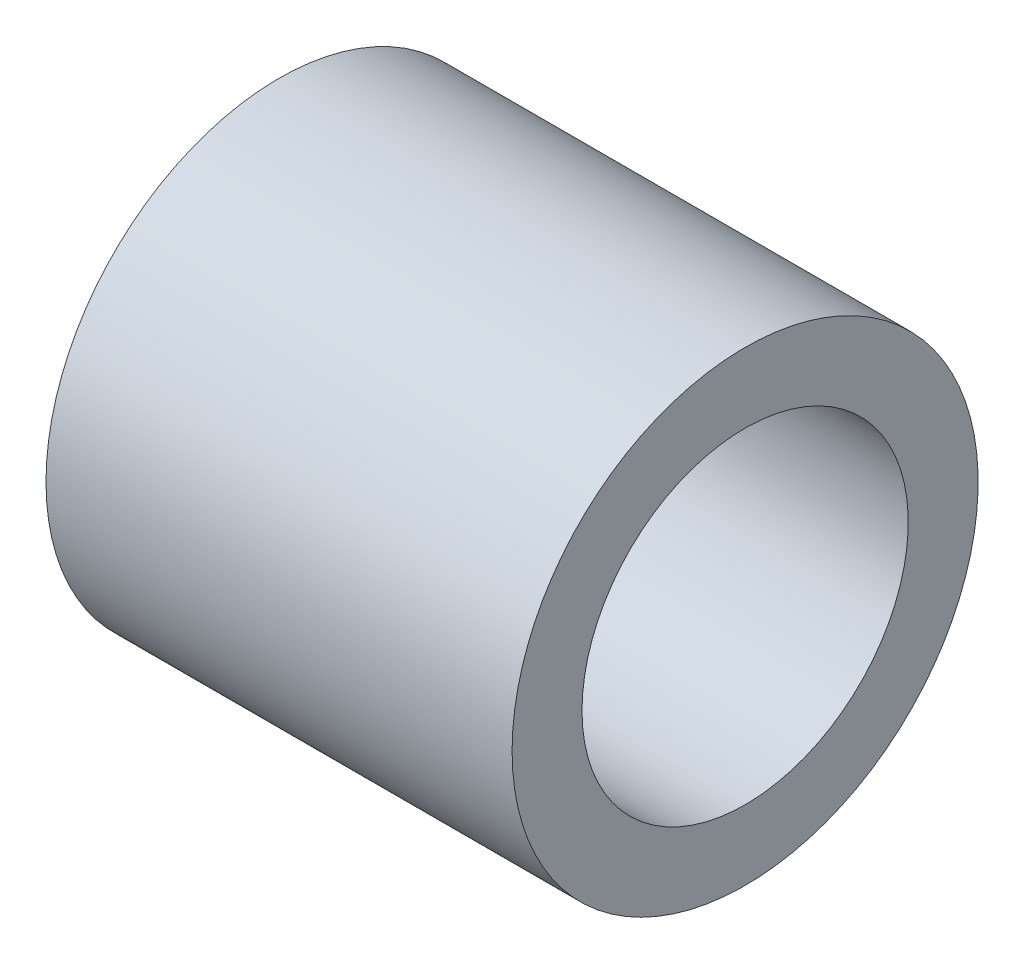
from build123d import *

# Parameters (mm, degrees)
ESQUISSE1_W = 20
ESQUISSE1_H = 3


with BuildPart() as part:
    # Esquisse1 → Base-Révolution (revolve)
    with BuildSketch(Plane.XY, mode=Mode.PRIVATE) as base_r_volution_sk:
        with Locations((10, 8.5)):
            Rectangle(ESQUISSE1_W, ESQUISSE1_H)
    revolve(base_r_volution_sk.sketch.rotate(Axis((0, 0, 0), (1, 0, 0)), 90), axis=Axis((0, 0, 0), (1, 0, 0)))


solid = part.part
